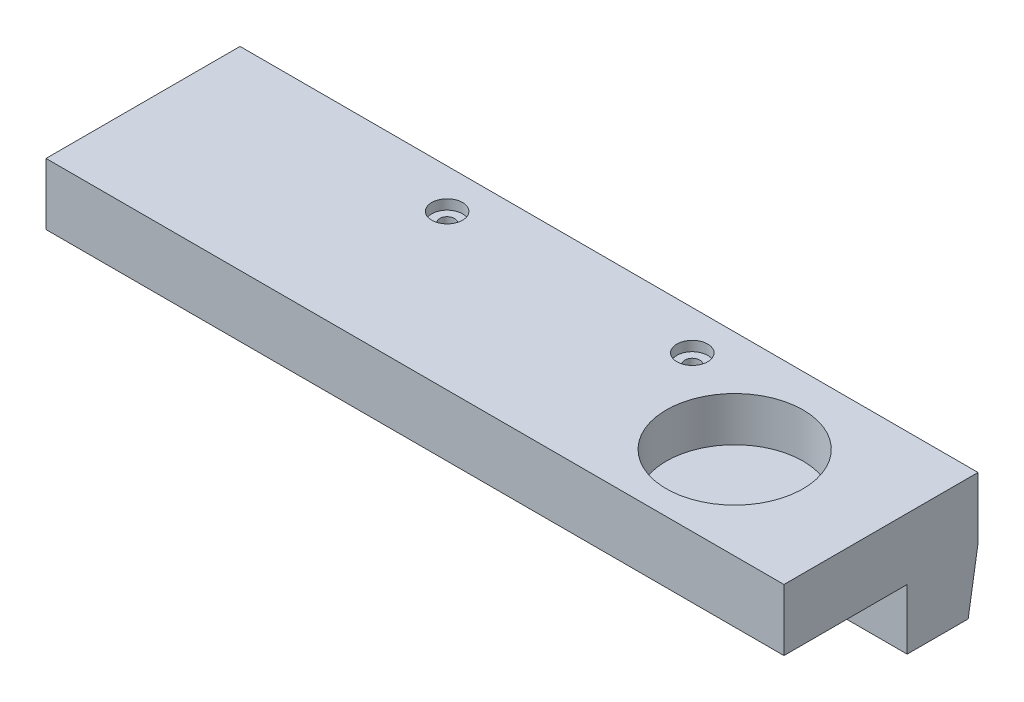
from build123d import *

# Parameters (mm, degrees)
SZKIC1_W                                             = 119.8
SZKIC1_H                                             = 10
DODANIE_WYCI_GNI_CIE2_DEPTH                          = 30
SZKIC21_W                                            = 119.8
SZKIC21_H                                            = 10
DODANIE_WYCI_GNI_CIE3_DEPTH                          = 9.8
POG_BIENIE_WALCOWE_POD_M2_WKR_T_DO_CZ_CI_D           = 2.4
POG_BIENIE_WALCOWE_POD_M2_WKR_T_DO_CZ_CI_CBORE_D     = 5
POG_BIENIE_WALCOWE_POD_M2_WKR_T_DO_CZ_CI_CBORE_DEPTH = 1.6
SZKIC28_R                                            = 11.1
WYTNIJ_WYCI_GNI_CIE1_DEPTH                           = 7.2
WYTNIJ_WYCI_GNI_CIE4_DEPTH                           = 124.8
DODANIE_WYCI_GNI_CIE5_DEPTH                          = 119.8
SZKIC34_W                                            = 119.8
SZKIC34_H                                            = 10
DODANIE_WYCI_GNI_CIE6_DEPTH                          = 1.5


with BuildPart() as part:
    # Szkic1 → Dodanie-wyciągnięcie2 (new body)
    with BuildSketch(Plane.XY):
        with Locations((1.59336777, 27.024849398)):
            Rectangle(SZKIC1_W, SZKIC1_H)
    extrude(amount=DODANIE_WYCI_GNI_CIE2_DEPTH)

    # Szkic21 → Dodanie-wyciągnięcie3 (add)
    with BuildSketch(Plane(origin=(0, 32.024849398, 0), x_dir=(1, 0, 0), z_dir=(0, 1, 0))):
        with Locations((1.59336777, -5)):
            Rectangle(SZKIC21_W, SZKIC21_H)
    extrude(amount=DODANIE_WYCI_GNI_CIE3_DEPTH)

    # Pogłębienie walcowe pod M2 wkręt do części metalowych z łbem stożkowym ściętym2 (through all)
    with Locations(Plane(origin=(0, 22.024849398, 0), x_dir=(-1, 0, 0), z_dir=(0, -1, 0))):
        with Locations((-21.49336777, -4.88), (18.30663223, -4.88)):
            CounterBoreHole(POG_BIENIE_WALCOWE_POD_M2_WKR_T_DO_CZ_CI_D / 2, POG_BIENIE_WALCOWE_POD_M2_WKR_T_DO_CZ_CI_CBORE_D / 2, POG_BIENIE_WALCOWE_POD_M2_WKR_T_DO_CZ_CI_CBORE_DEPTH)

    # Szkic28 → Wytnij-wyciągnięcie1 (cut)
    with BuildSketch(Plane.XZ.offset(-22.024849398)):
        with Locations((38.49336777, 15)):
            Circle(SZKIC28_R)
    extrude(amount=-WYTNIJ_WYCI_GNI_CIE1_DEPTH, mode=Mode.SUBTRACT)

    # Szkic31 → Wytnij-wyciągnięcie4 (cut)
    with BuildSketch(Plane(origin=(61.49336777, 0, 0), x_dir=(0, 0, -1), z_dir=(1, 0, 0))):
        Polygon((0, 41.824849398), (-0.096491228, 41.824849398), (0, 41.232541705), align=None)
    extrude(amount=-WYTNIJ_WYCI_GNI_CIE4_DEPTH, mode=Mode.SUBTRACT)

    # Szkic31<5> → Dodanie-wyciągnięcie5 (add)
    with BuildSketch(Plane(origin=(61.49336777, 0, 0), x_dir=(0, 0, -1), z_dir=(1, 0, 0))):
        Polygon((0, 41.232541705), (0, 32.024849398), (1.5, 32.024849398), (0.275236278, 39.543014399), align=None)
    extrude(amount=-DODANIE_WYCI_GNI_CIE5_DEPTH)

    # Szkic34 → Dodanie-wyciągnięcie6 (add)
    with BuildSketch(Plane(origin=(0, 0, 0), x_dir=(-1, 0, 0), z_dir=(0, 0, -1))):
        with Locations((-1.59336777, 27.024849398)):
            Rectangle(SZKIC34_W, SZKIC34_H)
    extrude(amount=DODANIE_WYCI_GNI_CIE6_DEPTH)


with BuildPart() as body_2:
    # Lustro2: mirrored copy
    add(part.part.mirror(Plane(origin=(-58.30663223, 22.024849398, 30), x_dir=(0, 0, 1), z_dir=(0, 1, 0))))


with BuildPart() as body_2_1:
    # Obiekt-Przenieś/Kopiuj1: moved
    add(body_2.part.moved(Location((0, -41, 0))))


solid = body_2_1.part
